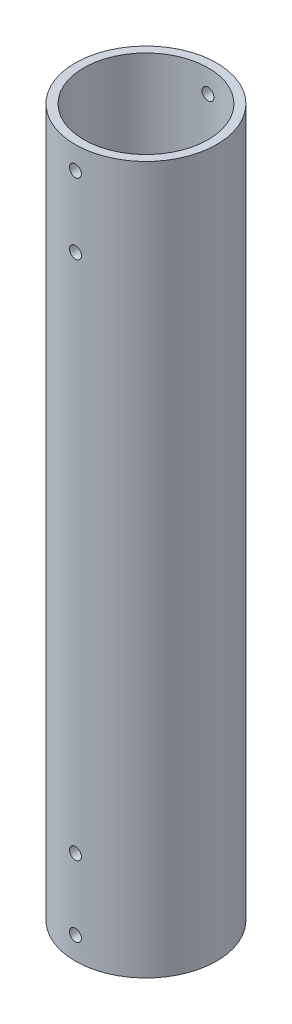
from build123d import *

# Parameters (mm, degrees)
SKETCH_1_R          = 25
SKETCH_1_R_2        = 22
EXTRUDE_1_DEPTH     = 250
SKETCH_6_R          = 2.1
CUT_EXTRUDE_2_DEPTH = 30


with BuildPart() as part:
    # 草图1 → 拉伸-薄壁1 (new body)
    with BuildSketch(Plane(origin=(0, 0, 0), x_dir=(1, 0, 0), z_dir=(0, 1, 0))):
        Circle(SKETCH_1_R)
        Circle(SKETCH_1_R_2, mode=Mode.SUBTRACT)
    extrude(amount=EXTRUDE_1_DEPTH)

    # 草图6 → 切除-拉伸2 (cut, symmetric)
    with BuildSketch(Plane.XY):
        with Locations((0, 242)):
            Circle(SKETCH_6_R)
        with Locations((0, 8)):
            Circle(SKETCH_6_R)
        with Locations((0, 217)):
            Circle(SKETCH_6_R)
        with Locations((0, 33)):
            Circle(SKETCH_6_R)
    extrude(amount=CUT_EXTRUDE_2_DEPTH, both=True, mode=Mode.SUBTRACT)


solid = part.part
